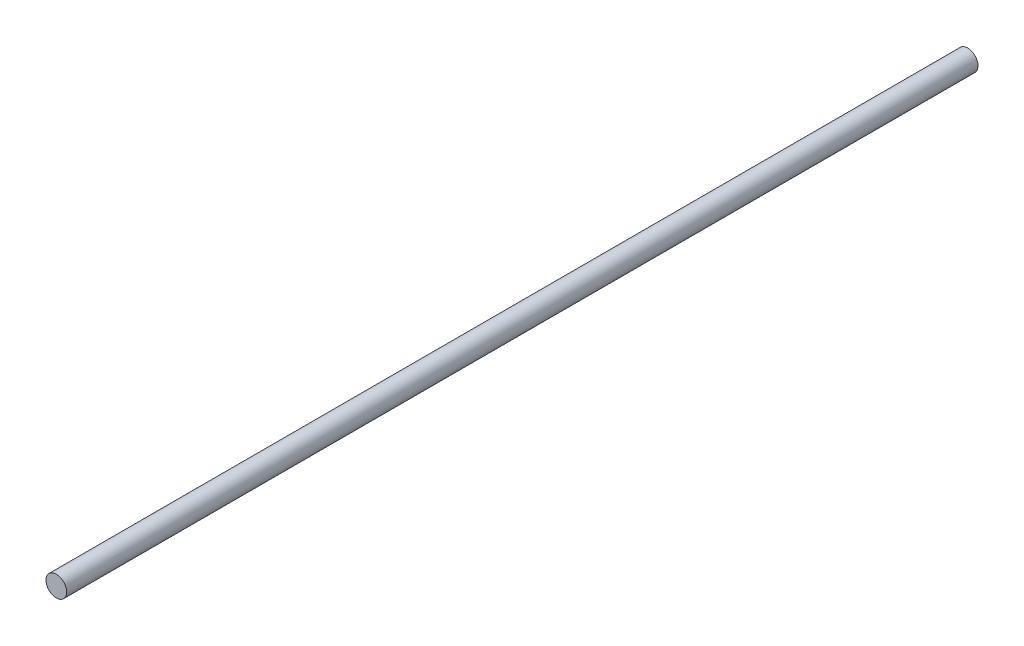
from build123d import *

# Parameters (mm, degrees)
SKETCH1_R           = 3.175
BOSS_EXTRUDE1_DEPTH = 280.53538


with BuildPart() as part:
    # Sketch1 → Boss-Extrude1 (new body)
    with BuildSketch(Plane.XY):
        Circle(SKETCH1_R)
    extrude(amount=BOSS_EXTRUDE1_DEPTH)


solid = part.part
